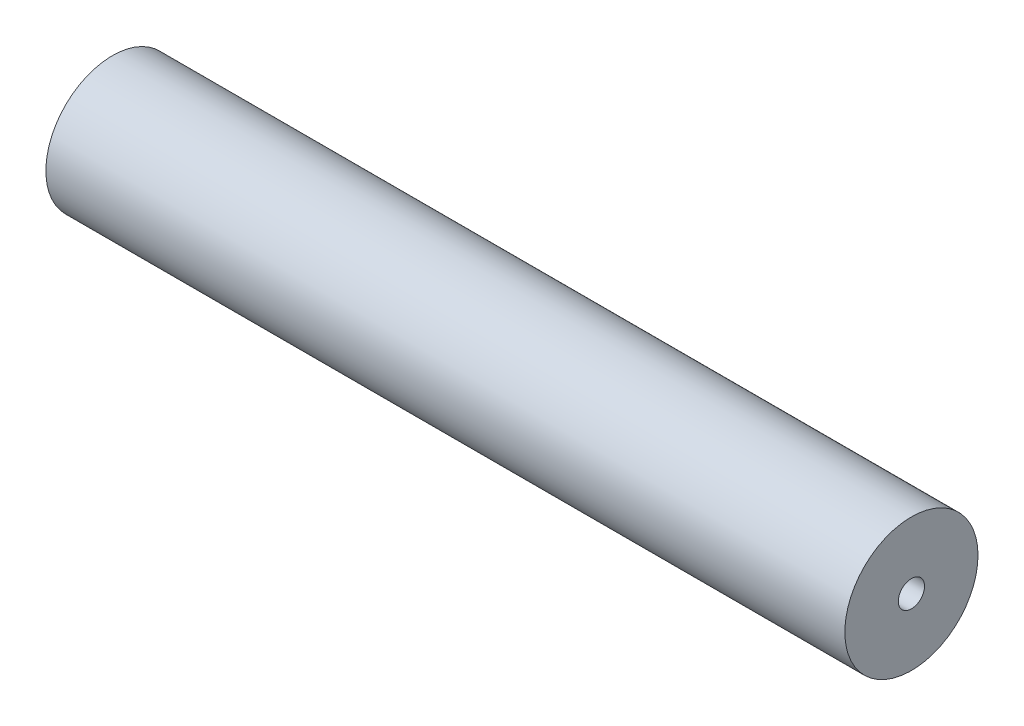
from build123d import *

# Parameters (mm, degrees)
SKETCH1_R                       = 38.1
BOSS_EXTRUDE1_DEPTH             = 457.2
M12_CLEARANCE_HOLE1_D           = 13.5
M12_CLEARANCE_HOLE1_DEPTH       = 21.344190822
M12_CLEARANCE_HOLE1_CSINK_D     = 13.55
M12_CLEARANCE_HOLE1_CSINK_ANGLE = 90
M12_CLEARANCE_HOLE1_TIP         = 4.055809178
M12_CLEARANCE_HOLE2_D           = 15
M12_CLEARANCE_HOLE2_DEPTH       = 20.893545357
M12_CLEARANCE_HOLE2_TIP         = 4.506454643


with BuildPart() as part:
    # Sketch1 → Boss-Extrude1 (new body)
    with BuildSketch(Plane(origin=(0, 0, 0), x_dir=(0, 0, -1), z_dir=(1, 0, 0))):
        Circle(SKETCH1_R)
    extrude(amount=BOSS_EXTRUDE1_DEPTH)

    # M12 Clearance Hole1
    with Locations(Plane.ZY):
        with Locations((0, 0)):
            CounterSinkHole(M12_CLEARANCE_HOLE1_D / 2, M12_CLEARANCE_HOLE1_CSINK_D / 2, depth=M12_CLEARANCE_HOLE1_DEPTH, counter_sink_angle=M12_CLEARANCE_HOLE1_CSINK_ANGLE)
            with Locations((0, 0, -(M12_CLEARANCE_HOLE1_DEPTH + M12_CLEARANCE_HOLE1_TIP / 2))):  # 118° drill point
                Cone(0, M12_CLEARANCE_HOLE1_D / 2, M12_CLEARANCE_HOLE1_TIP, mode=Mode.SUBTRACT)

    # M12 Clearance Hole2
    with Locations(Plane(origin=(457.2, 0, 0), x_dir=(0, 0, -1), z_dir=(1, 0, 0))):
        with Locations((0, 0)):
            Hole(M12_CLEARANCE_HOLE2_D / 2, depth=M12_CLEARANCE_HOLE2_DEPTH)
            with Locations((0, 0, -(M12_CLEARANCE_HOLE2_DEPTH + M12_CLEARANCE_HOLE2_TIP / 2))):  # 118° drill point
                Cone(0, M12_CLEARANCE_HOLE2_D / 2, M12_CLEARANCE_HOLE2_TIP, mode=Mode.SUBTRACT)


solid = part.part
